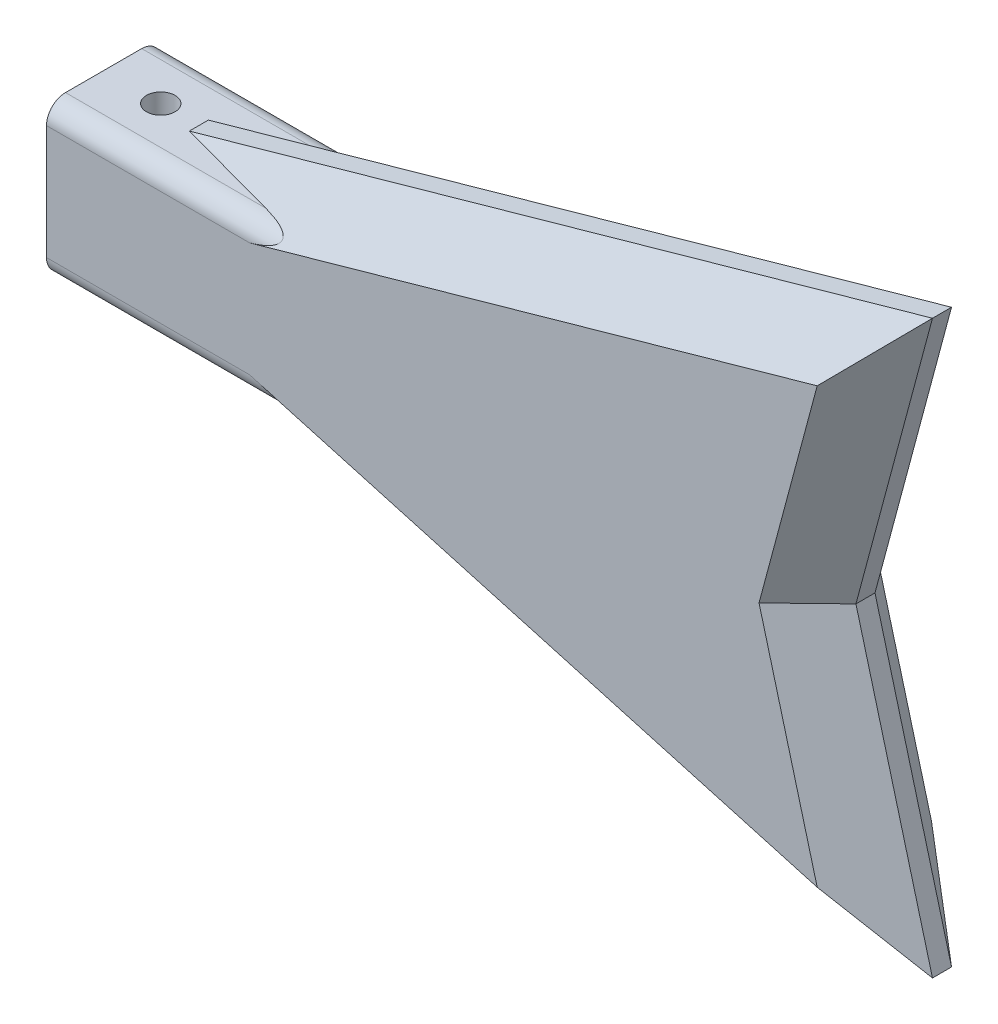
from build123d import *

# Parameters (mm, degrees)
BOSS_EXTRUDE8_DEPTH = 6
SKETCH7_R           = 5
CUT_EXTRUDE3_DEPTH  = 14
SKETCH8_R           = 1.5
CUT_EXTRUDE4_DEPTH  = 97.076913025
CHAMFER3_SIZE       = 5
FILLET4_R           = 2


with BuildPart() as part:
    # Sketch1 → Boss-Extrude8 (new, symmetric)
    with BuildSketch(Plane.XY):
        Polygon((10, -8), (88.038475773, -30), (80, 0), (88.038475773, 30), (10, 8), (0, 8), (0, -8), align=None)
    extrude(amount=BOSS_EXTRUDE8_DEPTH, both=True)

    # Sketch7 → Cut-Extrude3 (cut)
    with BuildSketch(Plane.ZY):
        Circle(SKETCH7_R)
    extrude(amount=-CUT_EXTRUDE3_DEPTH, mode=Mode.SUBTRACT)

    # Sketch8 → Cut-Extrude4 (cut, through all)
    with BuildSketch(Plane(origin=(0, 8, 0), x_dir=(1, 0, 0), z_dir=(0, 1, 0))):
        with Locations(Location((6, 0, 0), (0, 0, 180))):
            Circle(SKETCH8_R)
    extrude(amount=-CUT_EXTRUDE4_DEPTH, mode=Mode.SUBTRACT)

    # Chamfer3
    chamfer3_edges = [part.edges().sort_by_distance(p)[0] for p in [
        (49.019237886, -19, 6),
        (84.019237886, -15, 6),
        (84.019237886, 15, 6),
        (49.019237886, 19, 6),
        (49.019237886, 19, -6),
        (84.019237886, 15, -6),
        (84.019237886, -15, -6),
        (49.019237886, -19, -6),
    ]]
    chamfer(chamfer3_edges, length=CHAMFER3_SIZE)

    # Fillet4
    fillet4_edges = [part.edges().sort_by_distance(p)[0] for p in [
        (14.213662503, -8, 6),
        (14.213662503, 8, 6),
        (14.213662503, -8, -6),
        (14.213662503, 8, -6),
    ]]
    fillet(fillet4_edges, radius=FILLET4_R)


solid = part.part
